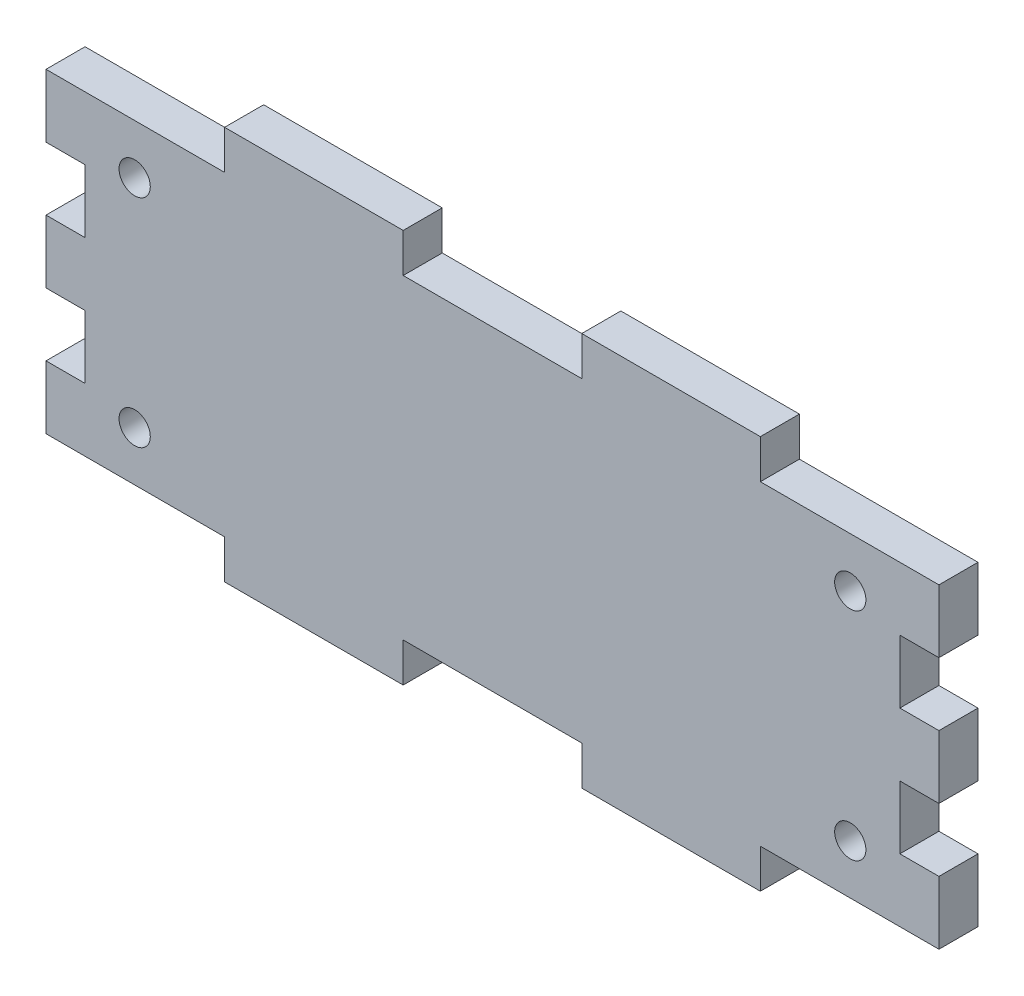
from build123d import *

# Parameters (mm, degrees)
SKETCH3_R           = 4
BOSS_EXTRUDE2_DEPTH = 10


with BuildPart() as part:
    # Sketch3 → Boss-Extrude2 (new body)
    with BuildSketch(Plane.XY):
        Polygon((102.429124183, -12.51217232), (56.709124183, -12.51217232), (56.709124183, -22.51217232), (10.989124183, -22.51217232), (10.989124183, -12.51217232), (-24.730875817, -12.51217232), (-34.730875817, -12.51217232), (-34.730875817, 3.64782768), (-24.730875817, 3.64782768), (-24.730875817, 19.80782768), (-34.730875817, 19.80782768), (-34.730875817, 35.96782768), (-24.730875817, 35.96782768), (-24.730875817, 52.12782768), (-34.730875817, 52.12782768), (-34.730875817, 68.28782768), (-24.730875817, 68.28782768), (10.989124183, 68.28782768), (10.989124183, 78.28782768), (56.709124183, 78.28782768), (56.709124183, 68.28782768), (102.429124183, 68.28782768), (102.429124183, 78.28782768), (148.149124183, 78.28782768), (148.149124183, 68.28782768), (183.869124183, 68.28782768), (193.869124183, 68.28782768), (193.869124183, 52.12782768), (183.869124183, 52.12782768), (183.869124183, 35.96782768), (193.869124183, 35.96782768), (193.869124183, 19.80782768), (183.869124183, 19.80782768), (183.869124183, 3.64782768), (193.869124183, 3.64782768), (193.869124183, -12.51217232), (183.869124183, -12.51217232), (148.149124183, -12.51217232), (148.149124183, -22.51217232), (102.429124183, -22.51217232), align=None)
        with Locations((-12.030875817, 55.58782768)):
            Circle(SKETCH3_R, mode=Mode.SUBTRACT)
        with Locations((171.169124183, 55.58782768)):
            Circle(SKETCH3_R, mode=Mode.SUBTRACT)
        with Locations((-12.030875817, 0.18782768)):
            Circle(SKETCH3_R, mode=Mode.SUBTRACT)
        with Locations((171.169124183, 0.18782768)):
            Circle(SKETCH3_R, mode=Mode.SUBTRACT)
    extrude(amount=BOSS_EXTRUDE2_DEPTH)


solid = part.part
